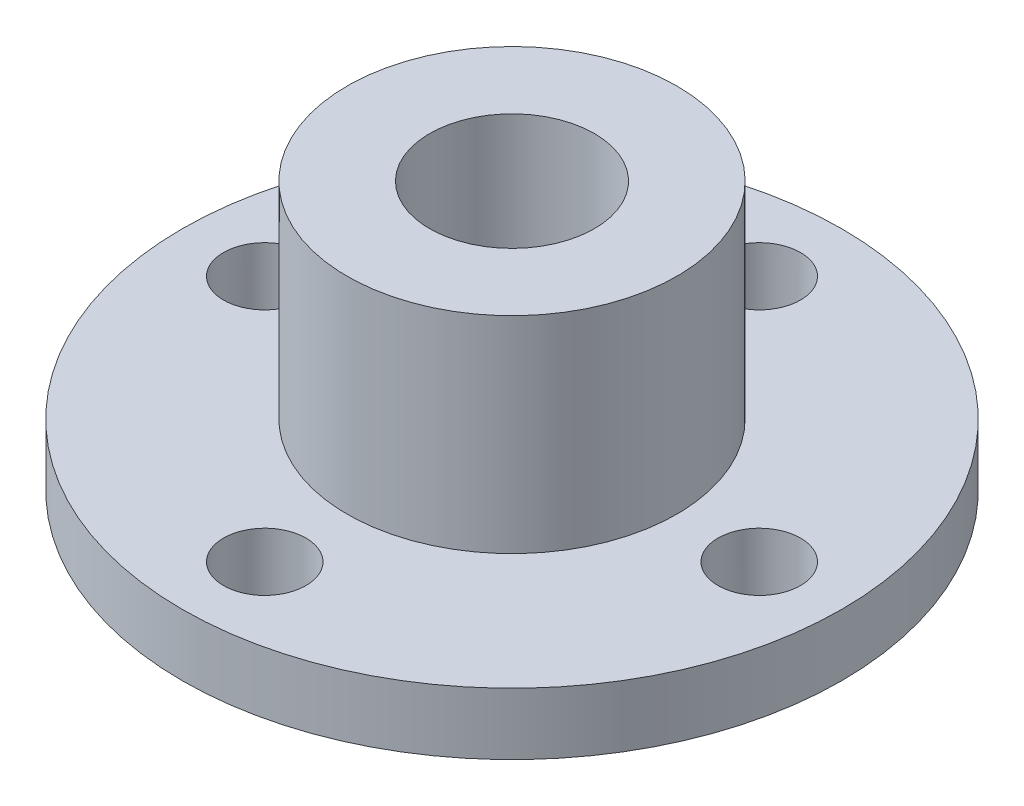
from build123d import *

# Parameters (mm, degrees)
SKETCH2_R          = 2
CUT_EXTRUDE1_DEPTH = 3
CIRPATTERN1_COUNT  = 4


with BuildPart() as part:
    # Sketch1 → Revolve1 (revolve)
    with BuildSketch(Plane.XY, mode=Mode.PRIVATE) as revolve1_sk:
        Polygon((0, 0), (0, -13), (12, -13), (12, -10), (4, -10), (4, 0), align=None)
    revolve(revolve1_sk.sketch.rotate(Axis((-4, -13, 0), (0, 1, 0)), 90), axis=Axis((-4, -13, 0), (0, 1, 0)))

    # Sketch2 → Cut-Extrude1 (cut)
    with BuildSketch(Plane(origin=(0, -10, 0), x_dir=(1, 0, 0), z_dir=(0, 1, 0))):
        with Locations(Location((-4, 12, 0), (0, 0, 270))):
            Circle(SKETCH2_R)
    cut_extrude1 = extrude(amount=-CUT_EXTRUDE1_DEPTH, mode=Mode.SUBTRACT)

    # CirPattern1: Cut-Extrude1 ×4 about axis
    cirpattern1_axis = Axis((-4, 0, 0), (0, 1, 0))
    for i in range(1, CIRPATTERN1_COUNT):
        add(cut_extrude1.rotate(cirpattern1_axis, i * 360 / CIRPATTERN1_COUNT), mode=Mode.SUBTRACT)


solid = part.part
